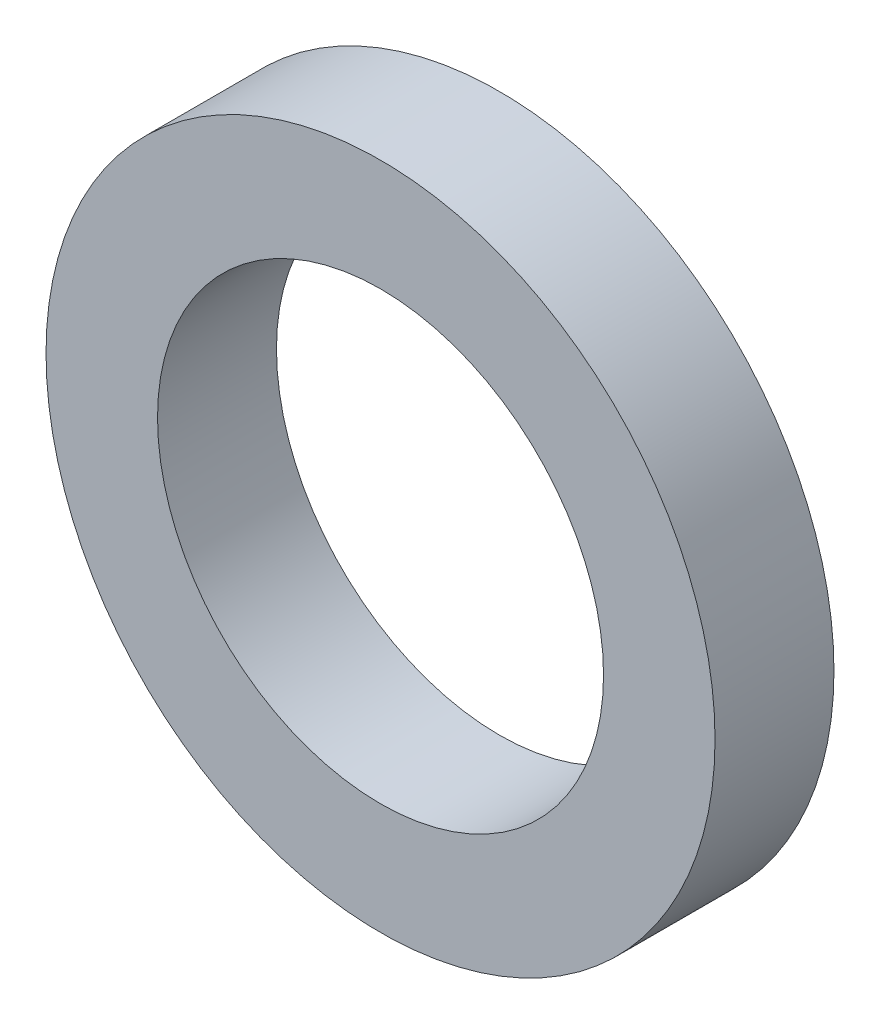
from build123d import *

# Parameters (mm, degrees)
SKETCH1_R           = 9
SKETCH1_R_2         = 6
BOSS_EXTRUDE1_DEPTH = 3.2


with BuildPart() as part:
    # Sketch1 → Boss-Extrude1 (new body)
    with BuildSketch(Plane.XY):
        Circle(SKETCH1_R)
        Circle(SKETCH1_R_2, mode=Mode.SUBTRACT)
    extrude(amount=BOSS_EXTRUDE1_DEPTH)


solid = part.part
